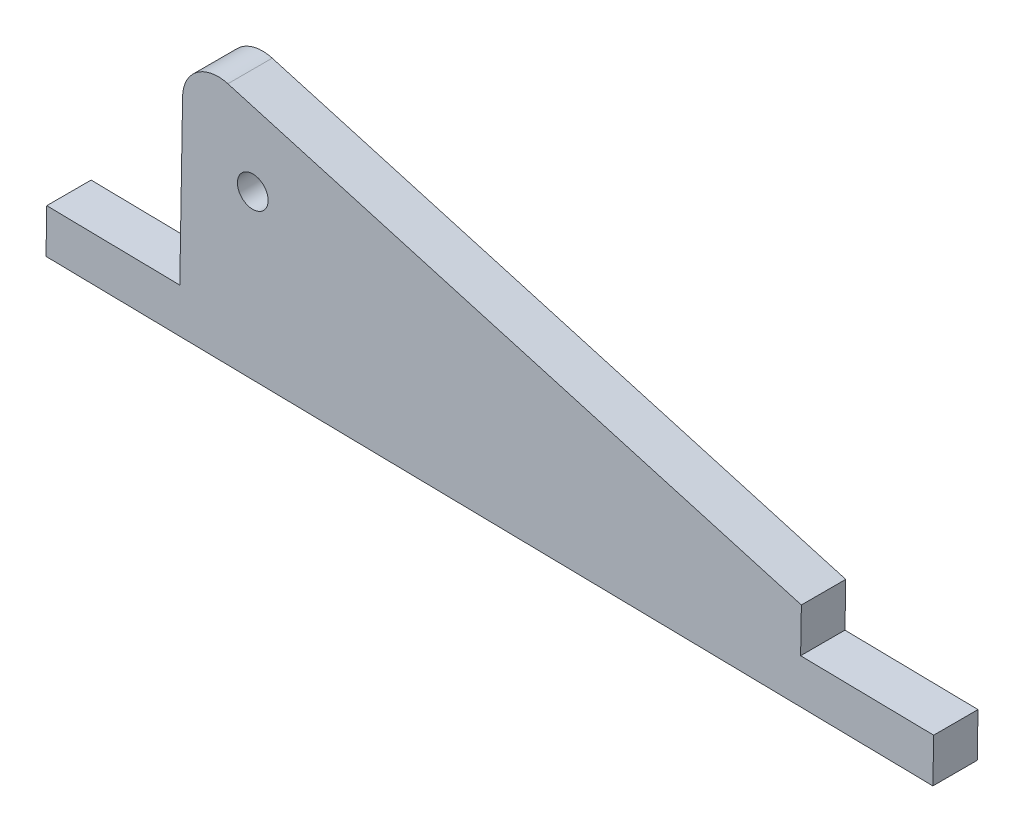
from build123d import *

# Parameters (mm, degrees)
BOSS_EXTRUDE2_DEPTH      = 1.5875
BOSS_EXTRUDE2_DEPTH_BACK = 1.5875
SKETCH4_R                = 1.1
FILLET2_R                = 2.54


with BuildPart() as part:
    # Sketch4 → Boss-Extrude2 (new, two sides: drawn at the far end of the back side and taken through both)
    with BuildSketch(Plane(origin=(0, 0, 41.275), x_dir=(-1, 0, 0), z_dir=(0, 0, -1)).offset(-BOSS_EXTRUDE2_DEPTH_BACK)):
        Polygon((205.973378569, 28.316894771), (215.496993412, 28.479330378), (215.442840335, 31.654330378), (259.682693032, 44.354330378), (259.886376268, 32.412363209), (259.940529345, 29.237363209), (269.464144188, 29.399798816), (269.51828939, 26.225260535), (206.027523772, 25.14235649), align=None)
        with Locations((254.716415099, 37.643475636)):
            Circle(SKETCH4_R, mode=Mode.SUBTRACT)
    extrude(amount=BOSS_EXTRUDE2_DEPTH + BOSS_EXTRUDE2_DEPTH_BACK)

    # Fillet2
    fillet2_edges = [part.edges().sort_by_distance(p)[0] for p in [
        (-259.682693032, 44.354330378, 41.275),
    ]]
    fillet(fillet2_edges, radius=FILLET2_R)


solid = part.part
